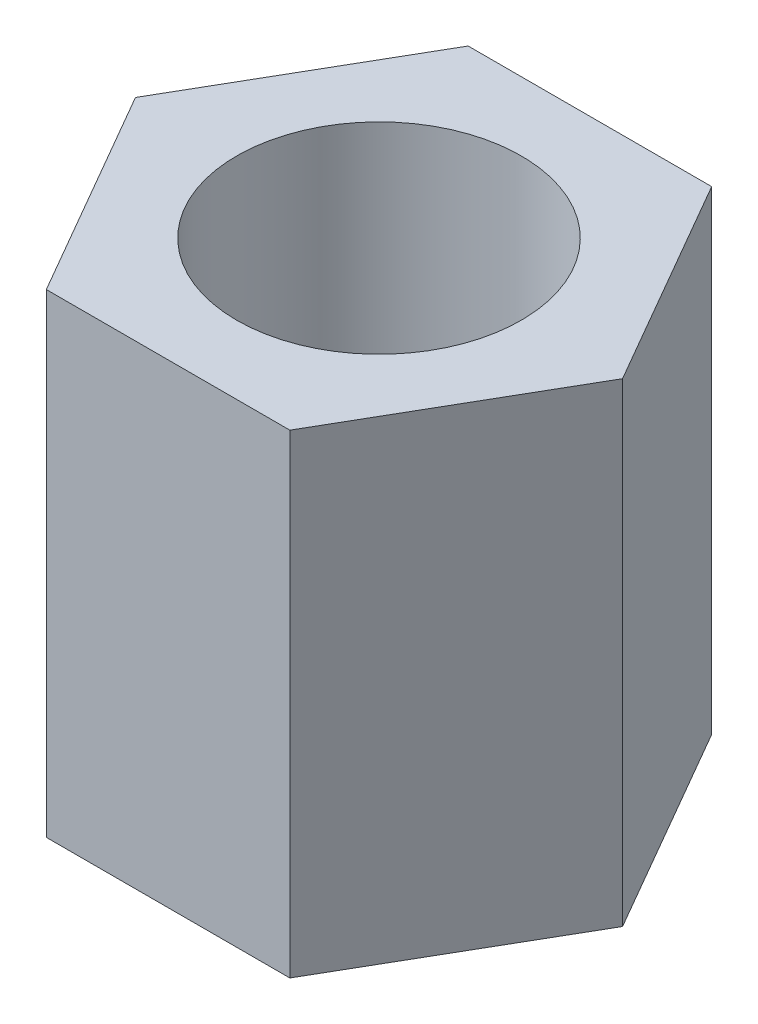
from build123d import *

# Parameters (mm, degrees)
SKETCH1_R           = 1.5
BOSS_EXTRUDE1_DEPTH = 5


with BuildPart() as part:
    # Sketch1 → Boss-Extrude1 (new body)
    with BuildSketch(Plane(origin=(0, 0, 0), x_dir=(1, 0, 0), z_dir=(0, 1, 0))):
        Polygon((2.566479006, 0), (1.283239503, 2.222636017), (-1.283239503, 2.222636017), (-2.566479006, 0), (-1.283239503, -2.222636017), (1.283239503, -2.222636017), align=None)
        with Locations(Location((0, 0, 0), (0, 0, 270))):
            Circle(SKETCH1_R, mode=Mode.SUBTRACT)
    extrude(amount=BOSS_EXTRUDE1_DEPTH)


solid = part.part
